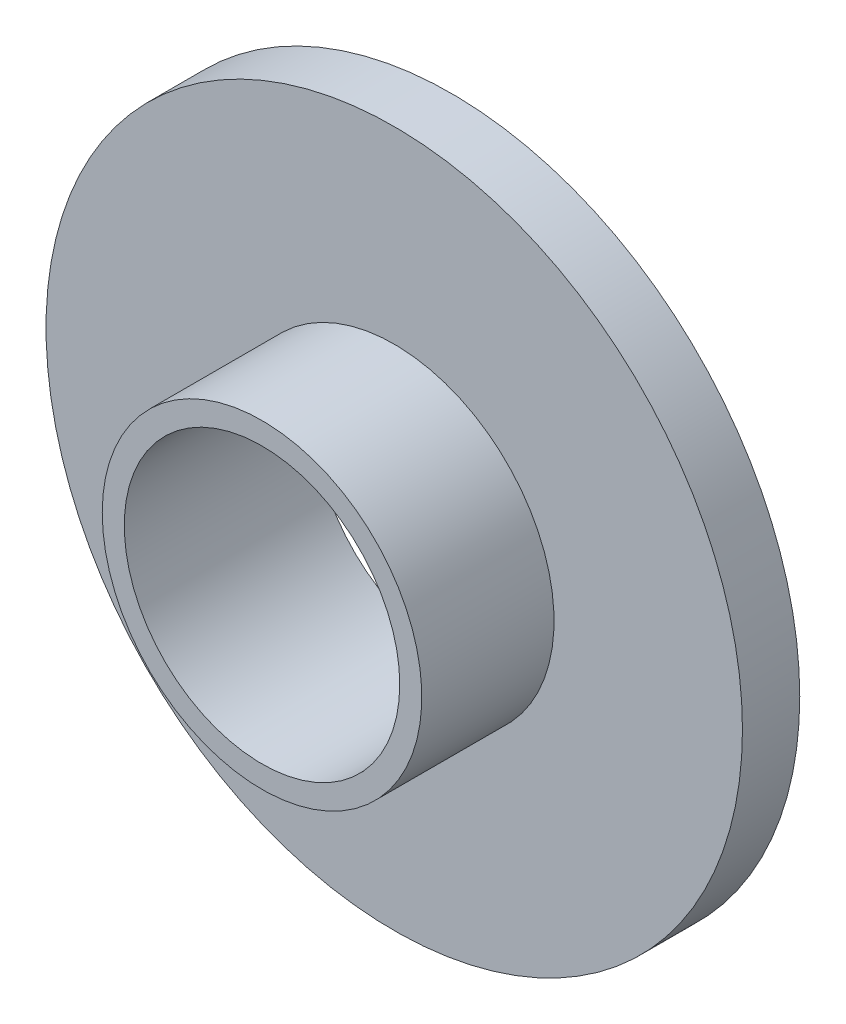
from build123d import *

# Parameters (mm, degrees)
SKETCH_1_R      = 7.9
SKETCH_1_R_2    = 3.125
EXTRUDE_1_DEPTH = 1.3
SKETCH_1_3_R    = 3.625
SKETCH_1_3_R_2  = 3.125
EXTRUDE_2_DEPTH = 4.3


with BuildPart() as part:
    # ｽｹｯﾁ1 → ﾎﾞｽ - 押し出し1 (new body)
    with BuildSketch(Plane.XY):
        Circle(SKETCH_1_R)
        Circle(SKETCH_1_R_2, mode=Mode.SUBTRACT)
    extrude(amount=EXTRUDE_1_DEPTH)

    # ｽｹｯﾁ1<3> → ﾎﾞｽ - 押し出し2 (add)
    with BuildSketch(Plane.XY):
        Circle(SKETCH_1_3_R)
        Circle(SKETCH_1_3_R_2, mode=Mode.SUBTRACT)
    extrude(amount=EXTRUDE_2_DEPTH)


solid = part.part
